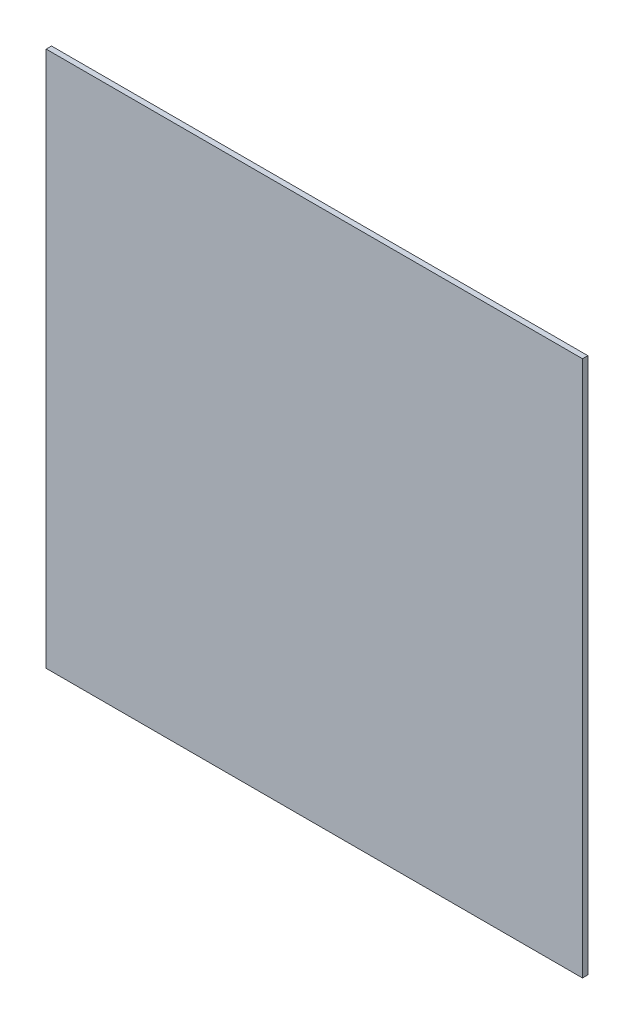
from build123d import *

# Parameters (mm, degrees)
ESQUISSE1_W        = 200
ESQUISSE1_H        = 200
BOSS_EXTRU_1_DEPTH = 2


with BuildPart() as part:
    # Esquisse1 → Boss.-Extru.1 (new body)
    with BuildSketch(Plane.XY):
        Rectangle(ESQUISSE1_W, ESQUISSE1_H)
    extrude(amount=BOSS_EXTRU_1_DEPTH)


solid = part.part
